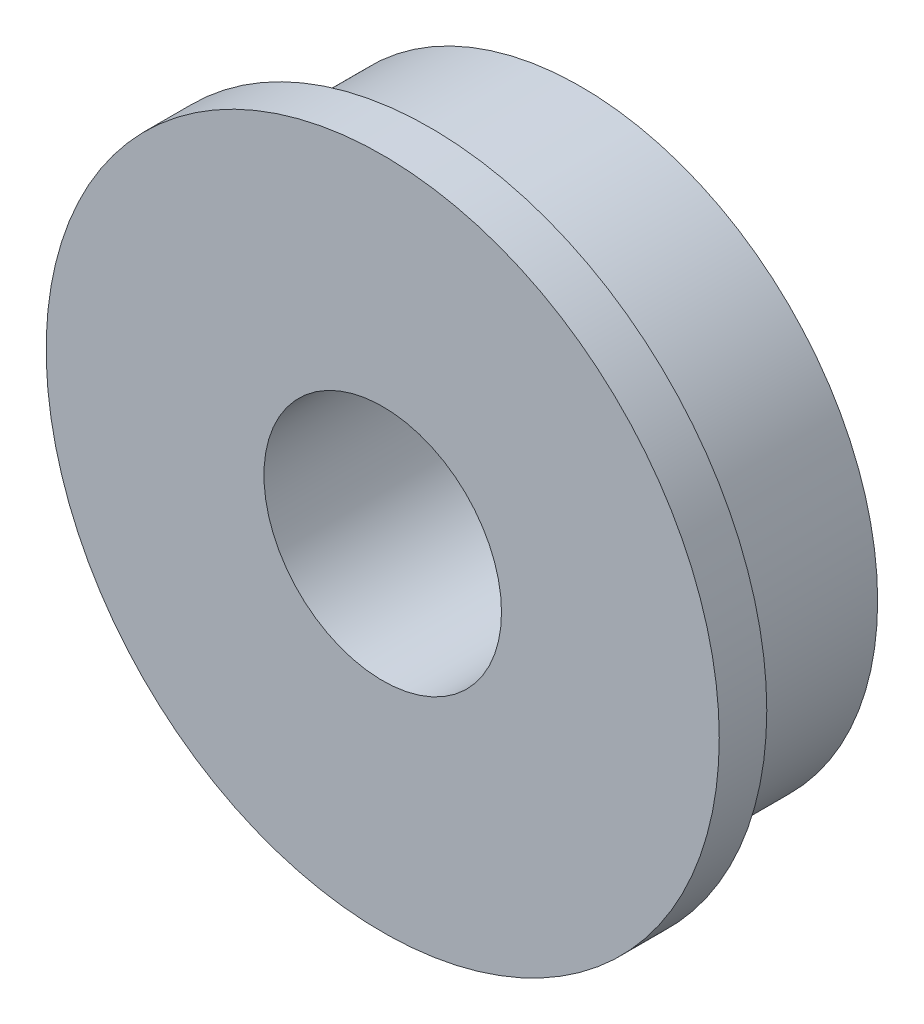
from build123d import *

# Parameters (mm, degrees)
SKETCH_1_R      = 7.5
SKETCH_1_R_2    = 3
EXTRUDE_1_DEPTH = 5
EXTRUDE_START   = -1.2
SKETCH_2_R      = 8.5
SKETCH_2_R_2    = 7.5
EXTRUDE_2_DEPTH = 1.2


with BuildPart() as part:
    # 草图1 → 凸台-拉伸1 (new body)
    with BuildSketch(Plane.XY):
        Circle(SKETCH_1_R)
        Circle(SKETCH_1_R_2, mode=Mode.SUBTRACT)
    extrude(amount=EXTRUDE_1_DEPTH)

    # 草图2 → 凸台-拉伸2 (add)
    with BuildSketch(Plane.XY.offset(5).offset(EXTRUDE_START)):
        Circle(SKETCH_2_R)
        Circle(SKETCH_2_R_2, mode=Mode.SUBTRACT)
    extrude(amount=EXTRUDE_2_DEPTH)


solid = part.part
